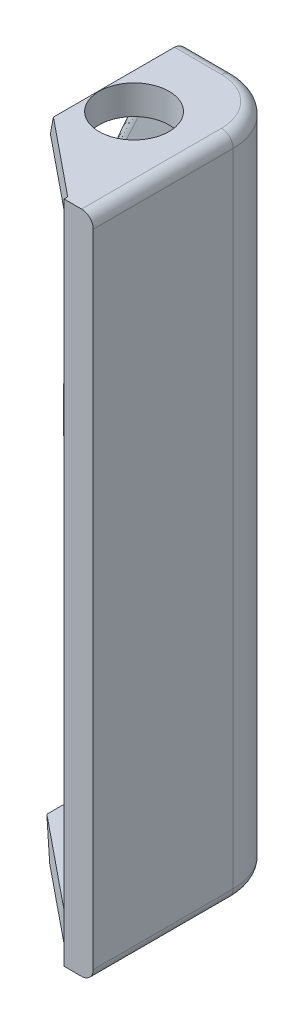
from build123d import *

# Parameters (mm, degrees)
BOSS_EXTRUDE1_DEPTH = 144.78
RIB1_REACH          = 329.768
SKETCH3_WALL_W      = 771.836553366
SKETCH3_WALL_H      = 12.7
CUT_EXTRUDE1_DEPTH  = 289.56
FILLET1_R           = 5.08
SKETCH5_R           = 15.24
CUT_EXTRUDE2_DEPTH  = 328.768276772


with BuildPart() as part:
    # Sketch2 → Boss-Extrude1 (new, symmetric)
    with BuildSketch(Plane(origin=(0, 0, 0), x_dir=(1, 0, 0), z_dir=(0, 1, 0))):
        with BuildLine():
            Line((0, 0), (101.6, 0))
            ThreePointArc((101.6, 0), (119.560512242, -7.439487758), (127, -25.4))
            Line((127, -25.4), (127, -86.36))
            Line((127, -86.36), (114.3, -86.36))
            Line((114.3, -86.36), (114.3, -38.1))
            ThreePointArc((114.3, -38.1), (106.860512242, -20.139487758), (88.9, -12.7))
            Line((88.9, -12.7), (0, -12.7))
            Line((0, -12.7), (0, 0))
        make_face()
    extrude(amount=BOSS_EXTRUDE1_DEPTH, both=True)

    # Sketch3 wall → Rib1 (add, up to next)
    with BuildSketch(Plane(origin=(69.945945205, 144.78, 48.739427344), x_dir=(0.776098946536, 0, 0.630611152126), z_dir=(0.630611152126, 0, -0.776098946536)), mode=Mode.PRIVATE) as rib1_sk1:
        with Locations((0, 6.35)):
            Rectangle(SKETCH3_WALL_W, SKETCH3_WALL_H)
    rib1_tool1 = extrude(rib1_sk1.sketch, amount=RIB1_REACH, mode=Mode.PRIVATE) - part.part
    rib1 = rib1_tool1.solids().sort_by_distance((69.945945205, 144.78, 48.739427344))[0]
    add(rib1)

    # Mirror1: Rib1 across plane
    add(rib1.mirror(Plane.ZX))

    # Sketch4 → Cut-Extrude1 (cut)
    with BuildSketch(Plane(origin=(0, 0, 0), x_dir=(-1, 0, 0), z_dir=(0, 0, -1))):
        with BuildLine():
            Line((-81.089693515, 144.78), (0, 144.78))
            Line((0, 144.78), (0, -144.78))
            Line((0, -144.78), (-72.453889421, -144.78))
            add(Edge.make_bspline(
                [(-81.089693515, 144.78), (-22.496571769, 42.315365933), (-25.923555625, -60.216187191), (-72.453889421, -144.78)],
                knots=[0, 0, 0, 0, 1, 1, 1, 1], degree=3))
        make_face()
    extrude(amount=-CUT_EXTRUDE1_DEPTH, mode=Mode.SUBTRACT)

    # Fillet1
    fillet1_edges = [part.edges().sort_by_distance(p)[0] for p in [
        (127, 144.78, 55.88),
        (119.560512242, 144.78, 7.439487758),
        (91.344846758, 144.78, 0),
        (127, -144.78, 55.88),
        (119.560512242, -144.78, 7.439487758),
        (37.55873854, 0.944564154, 0),
        (87.02694471, -144.78, 0),
        (37.555382274, 0.862578583, 12.7),
    ]]
    fillet(fillet1_edges, radius=FILLET1_R)

    # Sketch5 → Cut-Extrude2 (cut, through all)
    with BuildSketch(Plane.XZ.offset(144.78)):
        with Locations(Location((96.52, 38.1, 0), (0, 0, 270))):
            Circle(SKETCH5_R)
    extrude(amount=-CUT_EXTRUDE2_DEPTH, mode=Mode.SUBTRACT)


solid = part.part
